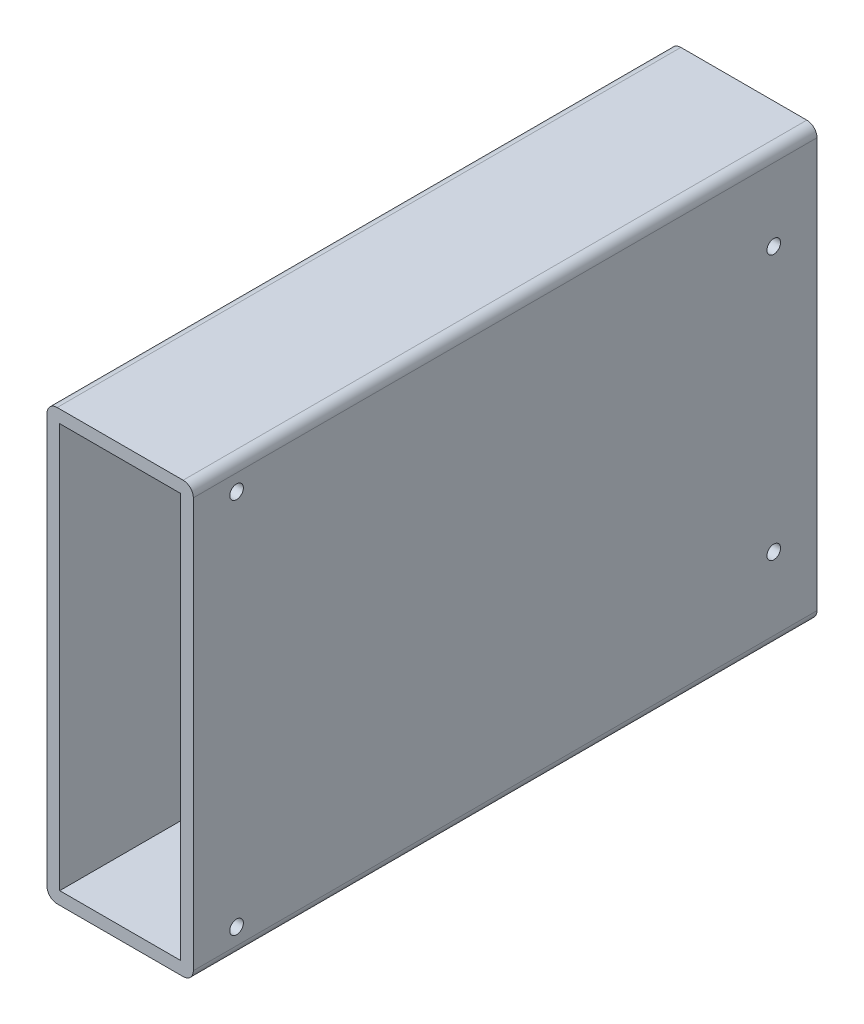
from build123d import *

# Parameters (mm, degrees)
SKETCH1_W                = 155.575
SKETCH1_H                = 107.237500028
BOSS_EXTRUDE1_DEPTH      = 36.5
SHELL2_T                 = -3.175
FILLET1_R                = 2.54
CUT_EXTRUDE2_REACH       = 194.447
SKETCH7_R                = 1.2
SKETCH7_W                = 15
SKETCH7_H                = 15
SKETCH8_R                = 2.38125
CUT_EXTRUDE3_DEPTH       = 190.889155594
M3_CLEARANCE_HOLE1_D     = 3.4
M3_CLEARANCE_HOLE1_DEPTH = 3.175


with BuildPart() as part:
    # Sketch1 → Boss-Extrude1 (new body)
    with BuildSketch(Plane(origin=(0, 0, 0), x_dir=(0, 0, -1), z_dir=(1, 0, 0))):
        with Locations((77.7875, 53.618750014)):
            Rectangle(SKETCH1_W, SKETCH1_H)
    extrude(amount=BOSS_EXTRUDE1_DEPTH)

    # Shell2
    shell2_openings = [part.faces().sort_by_distance(p)[0] for p in [
        (18.25, 53.618750014, 0),
    ]]
    offset(amount=SHELL2_T, openings=shell2_openings, kind=Kind.INTERSECTION)

    # Fillet1
    fillet1_edges = [part.edges().sort_by_distance(p)[0] for p in [
        (36.5, 107.237500028, -77.7875),
        (0, 107.237500028, -77.7875),
        (0, 0, -77.7875),
        (36.5, 0, -77.7875),
    ]]
    fillet(fillet1_edges, radius=FILLET1_R)

    # Sketch7 → Cut-Extrude2 (cut, up to next)
    with BuildSketch(Plane(origin=(0, 0, -155.575), x_dir=(-1, 0, 0), z_dir=(0, 0, -1)), mode=Mode.PRIVATE) as cut_extrude2_sk1:
        with Locations((-7.175, 30)):
            Circle(SKETCH7_R)
    cut_extrude2_tool1 = extrude(cut_extrude2_sk1.sketch, amount=-CUT_EXTRUDE2_REACH, mode=Mode.PRIVATE) & part.part
    # Sketch7 → Cut-Extrude2 (cut, up to next)
    with BuildSketch(Plane(origin=(0, 0, -155.575), x_dir=(-1, 0, 0), z_dir=(0, 0, -1)), mode=Mode.PRIVATE) as cut_extrude2_sk2:
        with Locations((-7.175, 5)):
            Circle(SKETCH7_R)
    cut_extrude2_tool2 = extrude(cut_extrude2_sk2.sketch, amount=-CUT_EXTRUDE2_REACH, mode=Mode.PRIVATE) & part.part
    # Sketch7 → Cut-Extrude2 (cut, up to next)
    with BuildSketch(Plane(origin=(0, 0, -155.575), x_dir=(-1, 0, 0), z_dir=(0, 0, -1)), mode=Mode.PRIVATE) as cut_extrude2_sk3:
        with Locations((-20.675, 27.5)):
            Rectangle(SKETCH7_W, SKETCH7_H)
    cut_extrude2_tool3 = extrude(cut_extrude2_sk3.sketch, amount=-CUT_EXTRUDE2_REACH, mode=Mode.PRIVATE) & part.part
    add(cut_extrude2_tool1.solids().sort_by_distance((7.175, 30, -155.575))[0], mode=Mode.SUBTRACT)
    add(cut_extrude2_tool2.solids().sort_by_distance((7.175, 5, -155.575))[0], mode=Mode.SUBTRACT)
    add(cut_extrude2_tool3.solids().sort_by_distance((20.675, 27.5, -155.575))[0], mode=Mode.SUBTRACT)

    # Sketch8 → Cut-Extrude3 (cut, through all)
    with BuildSketch(Plane.XY.offset(-152.4)):
        with Locations((7.175, 25.4)):
            Circle(SKETCH8_R)
    extrude(amount=-CUT_EXTRUDE3_DEPTH, mode=Mode.SUBTRACT)

    # M3 Clearance Hole1
    with Locations(Plane(origin=(36.5, 0, 0), x_dir=(0, 0, -1), z_dir=(1, 0, 0))):
        with Locations((144.7875, 86.618750014), (144.7875, 20.618750014), (10.7875, 6.618750014), (10.7875, 100.618750014)):
            Hole(M3_CLEARANCE_HOLE1_D / 2, depth=M3_CLEARANCE_HOLE1_DEPTH)


solid = part.part
